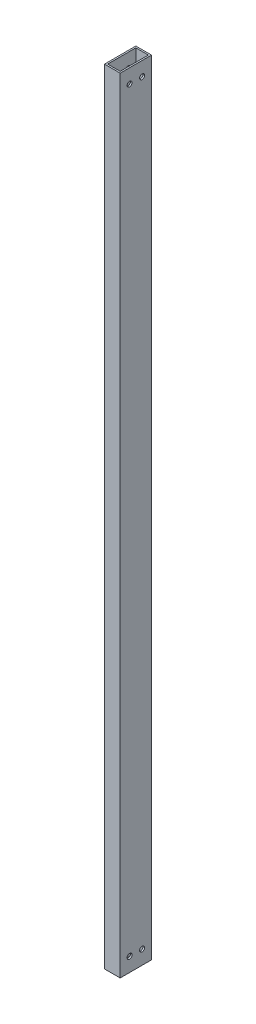
from build123d import *

# Parameters (mm, degrees)
CROQUIS1_W              = 40
CROQUIS1_H              = 1000
SALIENTE_EXTRUIR1_DEPTH = 20
CROQUIS2_W              = 16
CROQUIS2_H              = 36
CORTAR_EXTRUIR1_DEPTH   = 1000
CROQUIS3_R              = 3.175
CORTAR_EXTRUIR2_DEPTH   = 1000


with BuildPart() as part:
    # Croquis1 → Saliente-Extruir1 (new body)
    with BuildSketch(Plane(origin=(0, 0, 0), x_dir=(0, 0, -1), z_dir=(1, 0, 0))):
        with Locations((-20, 500)):
            Rectangle(CROQUIS1_W, CROQUIS1_H)
    extrude(amount=SALIENTE_EXTRUIR1_DEPTH)

    # Croquis2 → Cortar-Extruir1 (cut)
    with BuildSketch(Plane(origin=(0, 1000, 0), x_dir=(1, 0, 0), z_dir=(0, 1, 0))):
        with Locations((10, -20)):
            Rectangle(CROQUIS2_W, CROQUIS2_H)
    extrude(amount=-CORTAR_EXTRUIR1_DEPTH, mode=Mode.SUBTRACT)

    # Croquis3 → Cortar-Extruir2 (cut)
    with BuildSketch(Plane.ZY):
        with Locations((12, 982)):
            Circle(CROQUIS3_R)
        with Locations((28, 982)):
            Circle(CROQUIS3_R)
        with Locations((28, 18)):
            Circle(CROQUIS3_R)
        with Locations((12, 18)):
            Circle(CROQUIS3_R)
    extrude(amount=-CORTAR_EXTRUIR2_DEPTH, mode=Mode.SUBTRACT)


solid = part.part
